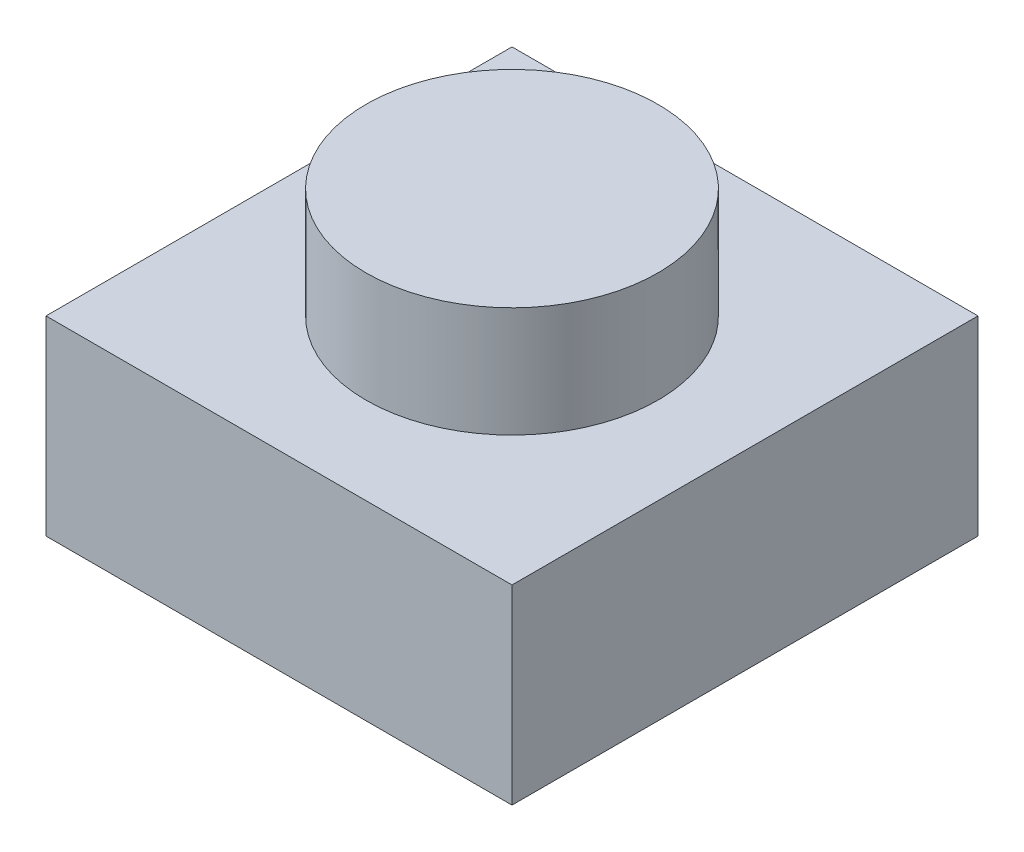
from build123d import *

# Parameters (mm, degrees)
SKETCH1_W           = 7.82
SKETCH1_H           = 7.82
BOSS_EXTRUDE1_DEPTH = 3.2
SKETCH2_R           = 2.45
BOSS_EXTRUDE2_DEPTH = 1.85
SHELL1_T            = -1.51


with BuildPart() as part:
    # Sketch1 → Boss-Extrude1 (new body)
    with BuildSketch(Plane(origin=(0, 0, 0), x_dir=(1, 0, 0), z_dir=(0, 1, 0))):
        Rectangle(SKETCH1_W, SKETCH1_H)
    extrude(amount=-BOSS_EXTRUDE1_DEPTH)

    # Sketch2 → Boss-Extrude2 (add)
    with BuildSketch(Plane(origin=(0, 0, 0), x_dir=(1, 0, 0), z_dir=(0, 1, 0))):
        with Locations(Location((0, 0, 0), (0, 0, 270))):
            Circle(SKETCH2_R)
    extrude(amount=BOSS_EXTRUDE2_DEPTH)

    # Shell1
    shell1_openings = [part.faces().sort_by_distance(p)[0] for p in [
        (0, -3.2, 0),
    ]]
    offset(amount=SHELL1_T, openings=shell1_openings, kind=Kind.INTERSECTION)


solid = part.part
